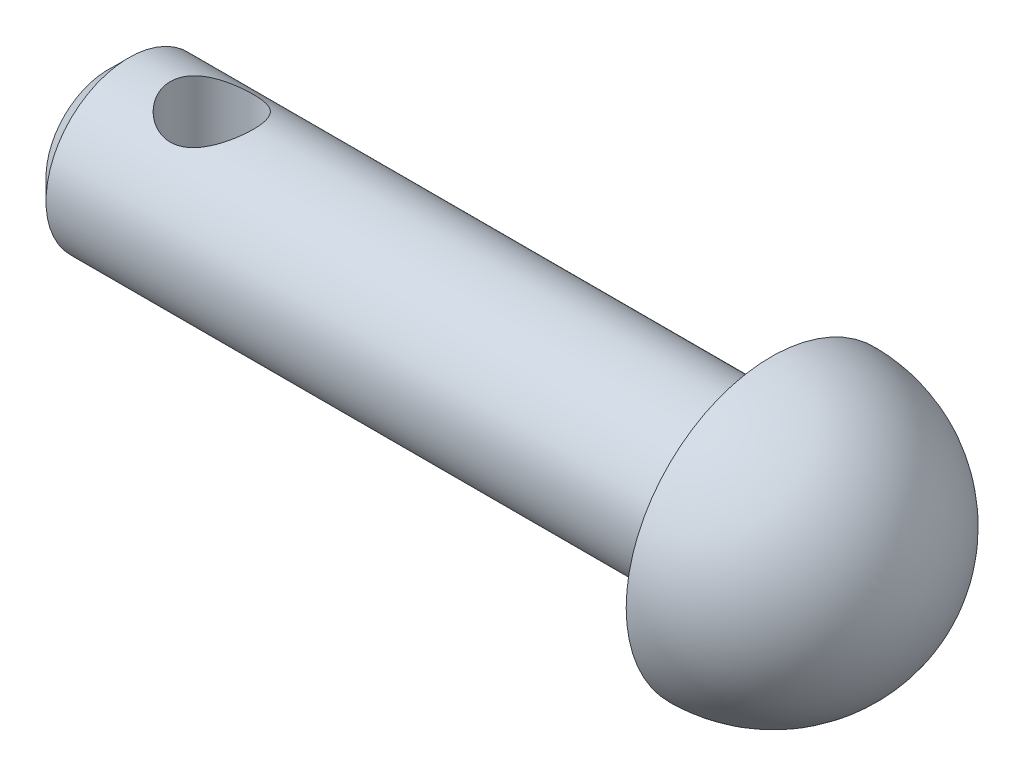
from build123d import *

# Parameters (mm, degrees)
SKETCH1_R               = 2
BOSS_EXTRUDE1_DEPTH     = 16
CUT_EXTRUDE1_DEPTH      = 17.248076809
CUT_EXTRUDE1_DEPTH_BACK = 17.248076809
SKETCH2_R               = 1
CHAMFER1_SIZE           = 0.5


with BuildPart() as part:
    # Sketch1 → Boss-Extrude1 (new body)
    with BuildSketch(Plane(origin=(0, 0, 0), x_dir=(0, 0, -1), z_dir=(1, 0, 0))):
        Circle(SKETCH1_R)
    extrude(amount=-BOSS_EXTRUDE1_DEPTH)

    # Sketch2 → Cut-Extrude1 (cut, two sides: drawn at the far end of the back side and taken through both)
    with BuildSketch(Plane(origin=(0, 0, 0), x_dir=(1, 0, 0), z_dir=(0, 1, 0)).offset(-CUT_EXTRUDE1_DEPTH_BACK)):
        with Locations(Location((-13.5, 0, 0), (0, 0, 270))):
            Circle(SKETCH2_R)
    extrude(amount=CUT_EXTRUDE1_DEPTH + CUT_EXTRUDE1_DEPTH_BACK, mode=Mode.SUBTRACT)

    # Sketch3 → Revolve1 (revolve)
    with BuildSketch(Plane(origin=(0, 0, 0), x_dir=(1, 0, 0), z_dir=(0, 1, 0))):
        with BuildLine():
            Line((0, 0), (0, -3.5))
            ThreePointArc((0, -3.5), (2.510871365, -2.481181976), (3.6, 0))
            Line((3.6, 0), (0, 0))
        make_face()
    revolve(axis=Axis((-3.287029336, 0, 0), (1, 0, 0)))

    # Chamfer1
    chamfer1_edges = [part.edges().sort_by_distance(p)[0] for p in [
        (-16, 0, 2),
    ]]
    chamfer(chamfer1_edges, length=CHAMFER1_SIZE)


solid = part.part
